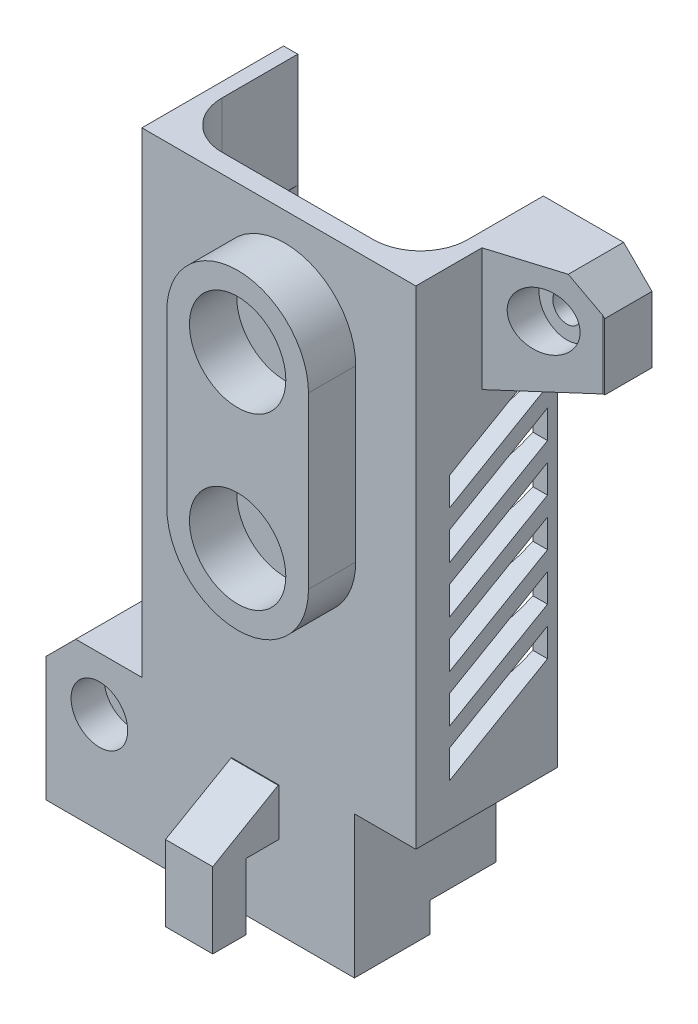
from build123d import *

# Parameters (mm, degrees)
P_IDAT_VYSUNUT_M1_DEPTH       = 6
P_IDAT_VYSUNUT_M2_DEPTH       = 4
P_IDAT_START                  = -18.7
P_IDAT_VYSUNUT_M3_DEPTH       = 18.7
P_IDAT_VYSUNUT_M4_DEPTH       = 36
P_IDAT_VYSUNUT_M5_DEPTH       = 12
P_IDAT_VYSUNUT_M6_DEPTH       = 18.7
SKICA10_W                     = 6.5
SKICA10_H                     = 16.04047294
ODEBRAT_VYSUNUT_M2_DEPTH      = 15
SKICA4_R                      = 4.125470306
ODEBRAT_VYSUNUT_M3_DEPTH      = 7
SKICA11_R                     = 1.6
P_IDAT_VYSUNUT_M7_DEPTH       = 15
SKICA12_R                     = 5
ODEBRAT_VYSUNUT_M4_DEPTH      = 10
SKICA13_R                     = 3
ODEBRAT_VYSUNUT_M5_DEPTH      = 3.5
ODEBRAT_VYSUNUT_M6_REACH      = 69.578
ODEBRAT_VYSUNUT_M6_END_RADIUS = 13
ODEBRAT_START                 = -8
SKICA15_R                     = 1.5
ODEBRAT_VYSUNUT_M7_DEPTH      = 8
ODEBRAT_VYSUNUT_M8_REACH      = 64.249
ODEBRAT_VYSUNUT_M8_END_RADIUS = 13
SKICA16_R                     = 13
SKICA17_W                     = 5
SKICA17_H                     = 10
P_IDAT_VYSUNUT_M8_DEPTH       = 10
ZKOSEN_1_SIZE                 = 3
ZKOSEN_1_SIZE2                = 9.812557855
ZKOSEN_2_SIZE                 = 3
ZKOSEN_2_SIZE2                = 9.812557855
SKICA18_R                     = 1.5
ODEBRAT_VYSUNUT_M9_DEPTH      = 4
SKICA19_R                     = 2.955100019
ODEBRAT_VYSUNUT_M10_DEPTH     = 4
ZKOSEN_3_SIZE                 = 3
SKICA20_W                     = 5
SKICA20_H                     = 5
P_IDAT_VYSUNUT_M9_DEPTH       = 7
SKICA21_W                     = 5
SKICA21_H                     = 3.5
P_IDAT_VYSUNUT_M10_DEPTH      = 7
ZKOSEN_4_SIZE                 = 4
ZKOSEN_4_SIZE2                = 6.92820323
SKICA22_R                     = 5.1
P_IDAT_VYSUNUT_M11_DEPTH      = 5


with BuildPart() as part:
    # Skica2 → Přidat vysunutím1 (new body)
    with BuildSketch(Plane.XZ):
        with BuildLine():
            Line((8, 0), (6, 0))
            ThreePointArc((6, 0), (0, 6), (-6, 0))
            Line((-6, 0), (-8, 0))
            ThreePointArc((-8, 0), (0, 8), (8, 0))
        make_face()
    extrude(amount=P_IDAT_VYSUNUT_M1_DEPTH)



with BuildPart() as body_2:
    # Skica3 → Přidat vysunutím2 (new body)
    with BuildSketch(Plane.XZ.offset(9.7)):
        with BuildLine():
            Line((4.5, 0), (8, 0))
            ThreePointArc((8, 0), (0, 8), (-8, 0))
            Line((-8, 0), (-4.5, 0))
            Line((-4.5, 0), (-2, 0))
            ThreePointArc((-2, 0), (0, 2), (2, 0))
            Line((2, 0), (4.5, 0))
        make_face()
    extrude(amount=P_IDAT_VYSUNUT_M2_DEPTH)


with BuildPart() as part_1:
    add(part.part)

    add(body_2.part)  # Přidat vysunutím3 merges body 2
    # Skica6 → Přidat vysunutím3 (add)
    with BuildSketch(Plane.XZ.offset(13.7).offset(P_IDAT_START)):
        with BuildLine():
            Line((-13, 0), (-8, 0))
            ThreePointArc((-8, 0), (0, 8), (8, 0))
            Line((8, 0), (13, 0))
            ThreePointArc((13, 0), (0, 13), (-13, 0))
        make_face()
    extrude(amount=P_IDAT_VYSUNUT_M3_DEPTH)



with BuildPart() as body_2_2:
    # Skica7 → Přidat vysunutím4 (new body)
    with BuildSketch(Plane(origin=(0, 5, 0), x_dir=(1, 0, 0), z_dir=(0, 1, 0))):
        with BuildLine():
            Line((-13, 0), (-14.5, 0))
            Line((-14.5, 0), (-14.5, -15))
            Line((-14.5, -15), (14.5, -15))
            Line((14.5, -15), (14.5, 0))
            Line((14.5, 0), (13, 0))
            ThreePointArc((13, 0), (0, -13), (-13, 0))
        make_face()
    extrude(amount=P_IDAT_VYSUNUT_M4_DEPTH)

    # Skica8 → Přidat vysunutím5 (add)
    with BuildSketch(Plane(origin=(0, 41, 0), x_dir=(1, 0, 0), z_dir=(0, 1, 0))):
        with BuildLine():
            Line((-14.5, 0), (-13, 0))
            Line((-13, 0), (-13, -8))
            ThreePointArc((-13, -8), (-11.535533906, -11.535533906), (-8, -13))
            Line((-8, -13), (8, -13))
            ThreePointArc((8, -13), (11.535533906, -11.535533906), (13, -8))
            Line((13, -8), (13, 0))
            Line((13, 0), (14.5, 0))
            Line((14.5, 0), (14.5, -15))
            Line((14.5, -15), (-14.5, -15))
            Line((-14.5, -15), (-14.5, 0))
        make_face()
    extrude(amount=P_IDAT_VYSUNUT_M5_DEPTH)


with BuildPart() as part_2:
    add(part_1.part)

    add(body_2_2.part)  # Přidat vysunutím6 merges body 2 2
    # Skica9 → Přidat vysunutím6 (add)
    with BuildSketch(Plane.XZ.offset(-5)):
        with BuildLine():
            Line((13, 0), (14.5, 0))
            Line((14.5, 0), (14.5, 15))
            Line((14.5, 15), (-14.5, 15))
            Line((-14.5, 15), (-14.5, 0))
            Line((-14.5, 0), (-13, 0))
            ThreePointArc((-13, 0), (0, 13), (13, 0))
        make_face()
    extrude(amount=P_IDAT_VYSUNUT_M6_DEPTH)

    # Skica10 → Odebrat vysunutím2 (cut)
    with BuildSketch(Plane(origin=(0, 0, 0), x_dir=(-1, 0, 0), z_dir=(0, 0, -1))):
        with Locations((-11.25, -6.665379435)):
            Rectangle(SKICA10_W, SKICA10_H)
    extrude(amount=-ODEBRAT_VYSUNUT_M2_DEPTH, mode=Mode.SUBTRACT)

    # Skica4 → Odebrat vysunutím3 (cut)
    with BuildSketch(Plane(origin=(0, 0, 0), x_dir=(-1, 0, 0), z_dir=(0, 0, -1))):
        with Locations((-7.768024839, -14.685615905)):
            Circle(SKICA4_R)
    extrude(amount=-ODEBRAT_VYSUNUT_M3_DEPTH, mode=Mode.SUBTRACT)

    # Skica11 → Přidat vysunutím7 (add)
    with BuildSketch(Plane.XY):
        with BuildLine():
            Line((-24.65, -13.7), (-14.5, -13.7))
            Line((-14.5, -13.7), (-4.756948598, -13.7))
            ThreePointArc((-4.756948598, -13.7), (-3.5, -13.539429741), (-2.243051402, -13.7))
            Line((-2.243051402, -13.7), (-2, -13.7))
            Line((-2, -13.7), (-2, -9.7))
            Line((-2, -9.7), (-8, -9.7))
            Line((-8, -9.7), (-8, -6))
            Line((-8, -6), (-6, -6))
            Line((-6, -6), (-6, 0))
            Line((-6, 0), (-8, 0))
            Line((-8, 0), (-8, 5))
            Line((-8, 5), (-13, 5))
            Line((-13, 5), (-13, 10.965216354))
            Line((-13, 10.965216354), (-14.5, 10.965216354))
            Line((-14.5, 10.965216354), (-14.5, 2.610570259))
            Line((-14.5, 2.610570259), (-21.503374824, 2.610570259))
            Line((-21.503374824, 2.610570259), (-24.65, -0.536054918))
            Line((-24.65, -0.536054918), (-24.65, -13.7))
        make_face()
        with Locations(Location((-19, -3.039429741, 0), (0, 0, 180))):
            Circle(SKICA11_R, mode=Mode.SUBTRACT)
    extrude(amount=P_IDAT_VYSUNUT_M7_DEPTH)

    # Skica12 → Odebrat vysunutím4 (cut)
    with BuildSketch(Plane(origin=(0, 0, 0), x_dir=(-1, 0, 0), z_dir=(0, 0, -1))):
        with Locations((3.5, -18.539429741)):
            Circle(SKICA12_R)
    extrude(amount=-ODEBRAT_VYSUNUT_M4_DEPTH, mode=Mode.SUBTRACT)

    # Skica13 → Odebrat vysunutím5 (cut)
    with BuildSketch(Plane.XY.offset(15)):
        with Locations((-19, -3.039429741)):
            Circle(SKICA13_R)
    extrude(amount=-ODEBRAT_VYSUNUT_M5_DEPTH, mode=Mode.SUBTRACT)

    # Odebrat vysunutím6: up to this cylinder (the profile starts outside it)
    odebrat_vysunut_m6_end = Plane(origin=(0, 22.848748, 0), z_dir=(0, -1, 0)) * Cylinder(ODEBRAT_VYSUNUT_M6_END_RADIUS, 191.156, mode=Mode.PRIVATE)
    # Skica14 → Odebrat vysunutím6 (cut, up to the surface)
    with BuildSketch(Plane(origin=(14.5, 0, 0), x_dir=(0, 0, -1), z_dir=(1, 0, 0)), mode=Mode.PRIVATE) as odebrat_vysunut_m6_sk1:
        Polygon((-11.449426353, 13.848748302), (-1.057121507, 19.848748302), (-1.057121507, 16.848748302), (-11.449426353, 10.848748302), align=None)
    odebrat_vysunut_m6_tool1 = extrude(odebrat_vysunut_m6_sk1.sketch, amount=-ODEBRAT_VYSUNUT_M6_REACH, mode=Mode.PRIVATE) - odebrat_vysunut_m6_end
    add(odebrat_vysunut_m6_tool1.solids().sort_by_distance((14.5, 15.348748, 6.253274))[0], mode=Mode.SUBTRACT)
    # Skica14 → Odebrat vysunutím6 (cut, up to the surface)
    with BuildSketch(Plane(origin=(14.5, 0, 0), x_dir=(0, 0, -1), z_dir=(1, 0, 0)), mode=Mode.PRIVATE) as odebrat_vysunut_m6_sk2:
        Polygon((-11.449426353, 8.848748302), (-1.057121507, 14.848748302), (-1.057121507, 11.848748302), (-11.449426353, 5.848748302), align=None)
    odebrat_vysunut_m6_tool2 = extrude(odebrat_vysunut_m6_sk2.sketch, amount=-ODEBRAT_VYSUNUT_M6_REACH, mode=Mode.PRIVATE) - odebrat_vysunut_m6_end
    add(odebrat_vysunut_m6_tool2.solids().sort_by_distance((14.5, 10.348748, 6.253274))[0], mode=Mode.SUBTRACT)
    # Skica14 → Odebrat vysunutím6 (cut, up to the surface)
    with BuildSketch(Plane(origin=(14.5, 0, 0), x_dir=(0, 0, -1), z_dir=(1, 0, 0)), mode=Mode.PRIVATE) as odebrat_vysunut_m6_sk3:
        Polygon((-11.449426353, 18.848748302), (-1.057121507, 24.848748302), (-1.057121507, 21.848748302), (-11.449426353, 15.848748302), align=None)
    odebrat_vysunut_m6_tool3 = extrude(odebrat_vysunut_m6_sk3.sketch, amount=-ODEBRAT_VYSUNUT_M6_REACH, mode=Mode.PRIVATE) - odebrat_vysunut_m6_end
    add(odebrat_vysunut_m6_tool3.solids().sort_by_distance((14.5, 20.348748, 6.253274))[0], mode=Mode.SUBTRACT)
    # Skica14 → Odebrat vysunutím6 (cut, up to the surface)
    with BuildSketch(Plane(origin=(14.5, 0, 0), x_dir=(0, 0, -1), z_dir=(1, 0, 0)), mode=Mode.PRIVATE) as odebrat_vysunut_m6_sk4:
        Polygon((-11.449426353, 23.848748302), (-1.057121507, 29.848748302), (-1.057121507, 26.848748302), (-11.449426353, 20.848748302), align=None)
    odebrat_vysunut_m6_tool4 = extrude(odebrat_vysunut_m6_sk4.sketch, amount=-ODEBRAT_VYSUNUT_M6_REACH, mode=Mode.PRIVATE) - odebrat_vysunut_m6_end
    add(odebrat_vysunut_m6_tool4.solids().sort_by_distance((14.5, 25.348748, 6.253274))[0], mode=Mode.SUBTRACT)
    # Skica14 → Odebrat vysunutím6 (cut, up to the surface)
    with BuildSketch(Plane(origin=(14.5, 0, 0), x_dir=(0, 0, -1), z_dir=(1, 0, 0)), mode=Mode.PRIVATE) as odebrat_vysunut_m6_sk5:
        Polygon((-11.449426353, 28.848748302), (-1.057121507, 34.848748302), (-1.057121507, 31.848748302), (-11.449426353, 25.848748302), align=None)
    odebrat_vysunut_m6_tool5 = extrude(odebrat_vysunut_m6_sk5.sketch, amount=-ODEBRAT_VYSUNUT_M6_REACH, mode=Mode.PRIVATE) - odebrat_vysunut_m6_end
    add(odebrat_vysunut_m6_tool5.solids().sort_by_distance((14.5, 30.348748, 6.253274))[0], mode=Mode.SUBTRACT)
    # Skica14 → Odebrat vysunutím6 (cut, up to the surface)
    with BuildSketch(Plane(origin=(14.5, 0, 0), x_dir=(0, 0, -1), z_dir=(1, 0, 0)), mode=Mode.PRIVATE) as odebrat_vysunut_m6_sk6:
        Polygon((-11.449426353, 33.848748302), (-1.057121507, 39.848748302), (-1.057121507, 36.848748302), (-11.449426353, 30.848748302), align=None)
    odebrat_vysunut_m6_tool6 = extrude(odebrat_vysunut_m6_sk6.sketch, amount=-ODEBRAT_VYSUNUT_M6_REACH, mode=Mode.PRIVATE) - odebrat_vysunut_m6_end
    add(odebrat_vysunut_m6_tool6.solids().sort_by_distance((14.5, 35.348748, 6.253274))[0], mode=Mode.SUBTRACT)

    # Skica15 → Odebrat vysunutím7 (cut)
    with BuildSketch(Plane.ZY.offset(14.5).offset(ODEBRAT_START)):
        with Locations(Location((12, 35.965216354, 0), (0, 0, 240.366753373))):
            Circle(SKICA15_R)
        with Locations(Location((12, 11.965216354, 0), (0, 0, 240.366753373))):
            Circle(SKICA15_R)
    extrude(amount=ODEBRAT_VYSUNUT_M7_DEPTH, mode=Mode.SUBTRACT)

    # Odebrat vysunutím8: up to this cylinder (the profile starts outside it)
    odebrat_vysunut_m8_end = Plane(origin=(0, 23.965216, 0), z_dir=(0, -1, 0)) * Cylinder(ODEBRAT_VYSUNUT_M8_END_RADIUS, 155.498, mode=Mode.PRIVATE)
    # Skica16 → Odebrat vysunutím8 (cut, up to the surface)
    with BuildSketch(Plane.ZY.offset(14.5), mode=Mode.PRIVATE) as odebrat_vysunut_m8_sk1:
        with Locations((0, 23.965216354)):
            Circle(SKICA16_R)
    odebrat_vysunut_m8_tool1 = extrude(odebrat_vysunut_m8_sk1.sketch, amount=-ODEBRAT_VYSUNUT_M8_REACH, mode=Mode.PRIVATE) - odebrat_vysunut_m8_end
    add(odebrat_vysunut_m8_tool1.solids().sort_by_distance((-14.5, 23.965216, 0))[0], mode=Mode.SUBTRACT)

    # Skica17 → Přidat vysunutím8 (add)
    with BuildSketch(Plane(origin=(14.5, 0, 0), x_dir=(0, 0, -1), z_dir=(1, 0, 0))):
        with Locations((-2.5, 48)):
            Rectangle(SKICA17_W, SKICA17_H)
    extrude(amount=P_IDAT_VYSUNUT_M8_DEPTH)

    # Zkosení1
    zkosen_1_edges = [part_2.edges().sort_by_distance(p)[0] for p in [
        (14.5, 43, 2.5),
    ]]
    zkosen_1_side = [part_2.faces().sort_by_distance(p)[0] for p in [
        (14.5, 26.747010965, 8.398810193),
    ]]
    chamfer(zkosen_1_edges, length=ZKOSEN_1_SIZE, length2=ZKOSEN_1_SIZE2, reference=zkosen_1_side[0])

    # Zkosení2
    zkosen_2_edges = [part_2.edges().sort_by_distance(p)[0] for p in [
        (14.5, 46.5, 5),
    ]]
    zkosen_2_side = [part_2.faces().sort_by_distance(p)[0] for p in [
        (14.5, 26.323573909, 8.56811655),
    ]]
    chamfer(zkosen_2_edges, length=ZKOSEN_2_SIZE, length2=ZKOSEN_2_SIZE2, reference=zkosen_2_side[0])

    # Skica18 → Odebrat vysunutím9 (cut)
    with BuildSketch(Plane(origin=(0, 0, 0), x_dir=(-1, 0, 0), z_dir=(0, 0, -1))):
        with Locations((-19.5, 48)):
            Circle(SKICA18_R)
    extrude(amount=-ODEBRAT_VYSUNUT_M9_DEPTH, mode=Mode.SUBTRACT)

    # Skica19 → Odebrat vysunutím10 (cut)
    with BuildSketch(Plane(origin=(0, 0, 4), x_dir=(-1, 0, 0), z_dir=(0, 0, -1))):
        with Locations((-19.5, 48)):
            Circle(SKICA19_R)
    extrude(amount=-ODEBRAT_VYSUNUT_M10_DEPTH, mode=Mode.SUBTRACT)

    # Zkosení3
    zkosen_3_edges = [part_2.edges().sort_by_distance(p)[0] for p in [
        (24.5, 53, 2.5),
    ]]
    chamfer(zkosen_3_edges, length=ZKOSEN_3_SIZE)

    # Skica20 → Přidat vysunutím9 (add)
    with BuildSketch(Plane.XY.offset(15)):
        with Locations((-2.5, -2.5)):
            Rectangle(SKICA20_W, SKICA20_H)
    extrude(amount=P_IDAT_VYSUNUT_M9_DEPTH)

    # Skica21 → Přidat vysunutím10 (add)
    with BuildSketch(Plane.XZ.offset(5)):
        with Locations((-2.5, 20.25)):
            Rectangle(SKICA21_W, SKICA21_H)
    extrude(amount=P_IDAT_VYSUNUT_M10_DEPTH)

    # Zkosení4
    zkosen_4_edges = [part_2.edges().sort_by_distance(p)[0] for p in [
        (-2.5, 0, 22),
    ]]
    zkosen_4_side = [part_2.faces().sort_by_distance(p)[0] for p in [
        (-2.5, -6, 22),
    ]]
    chamfer(zkosen_4_edges, length=ZKOSEN_4_SIZE, length2=ZKOSEN_4_SIZE2, reference=zkosen_4_side[0])

    # Skica22 → Přidat vysunutím11 (add)
    with BuildSketch(Plane.XY.offset(15)):
        with BuildLine():
            Line((-6.864781882, 24.505037691), (-6.864781882, 42.505037691))
            ThreePointArc((-6.864781882, 42.505037691), (0.635218118, 50.005037691), (8.135218118, 42.505037691))
            Line((8.135218118, 42.505037691), (8.135218118, 24.505037691))
            ThreePointArc((8.135218118, 24.505037691), (0.635218118, 17.005037691), (-6.864781882, 24.505037691))
        make_face()
        with Locations((0.635218118, 42.505037691)):
            Circle(SKICA22_R, mode=Mode.SUBTRACT)
        with Locations((0.635218118, 24.505037691)):
            Circle(SKICA22_R, mode=Mode.SUBTRACT)
    extrude(amount=P_IDAT_VYSUNUT_M11_DEPTH)


solid = part_2.part
